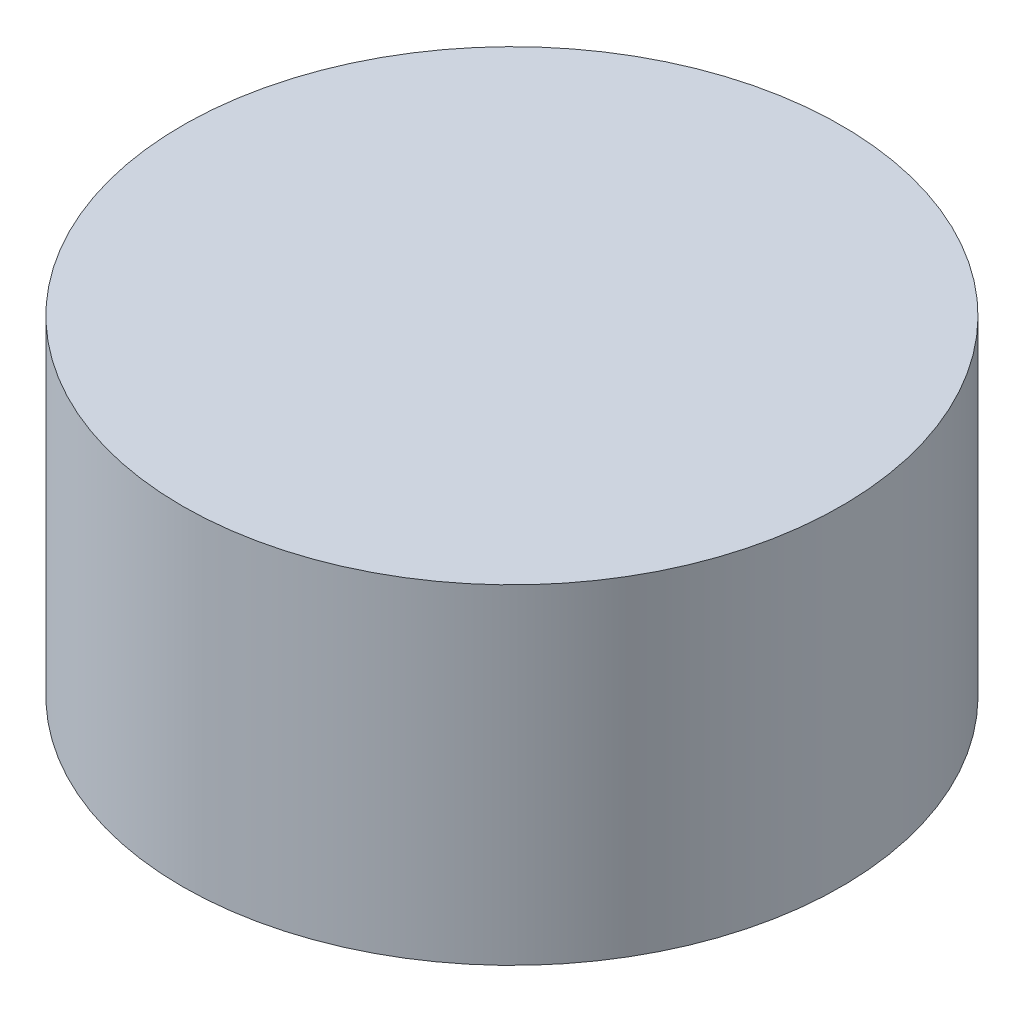
from build123d import *

# Parameters (mm, degrees)
SKETCH1_R           = 10
BOSS_EXTRUDE1_DEPTH = 10


with BuildPart() as part:
    # Sketch1 → Boss-Extrude1 (new body)
    with BuildSketch(Plane(origin=(0, 0, 0), x_dir=(1, 0, 0), z_dir=(0, 1, 0))):
        with Locations(Location((0, 0, 0), (0, 0, 270))):
            Circle(SKETCH1_R)
    extrude(amount=BOSS_EXTRUDE1_DEPTH)


solid = part.part
